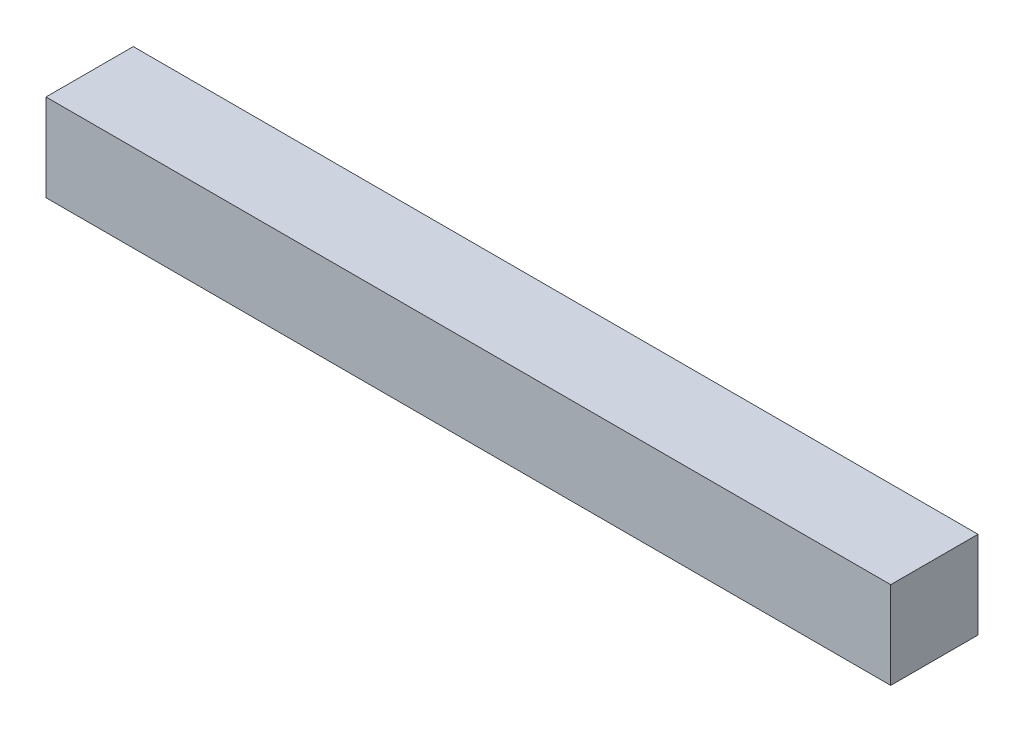
from build123d import *

# Parameters (mm, degrees)
SKETCH1_W           = 96.79
SKETCH1_H           = 10
BOSS_EXTRUDE1_DEPTH = 10


with BuildPart() as part:
    # Sketch1 → Boss-Extrude1 (new body)
    with BuildSketch(Plane.XY):
        with Locations((48.395, -5)):
            Rectangle(SKETCH1_W, SKETCH1_H)
    extrude(amount=BOSS_EXTRUDE1_DEPTH)


solid = part.part
